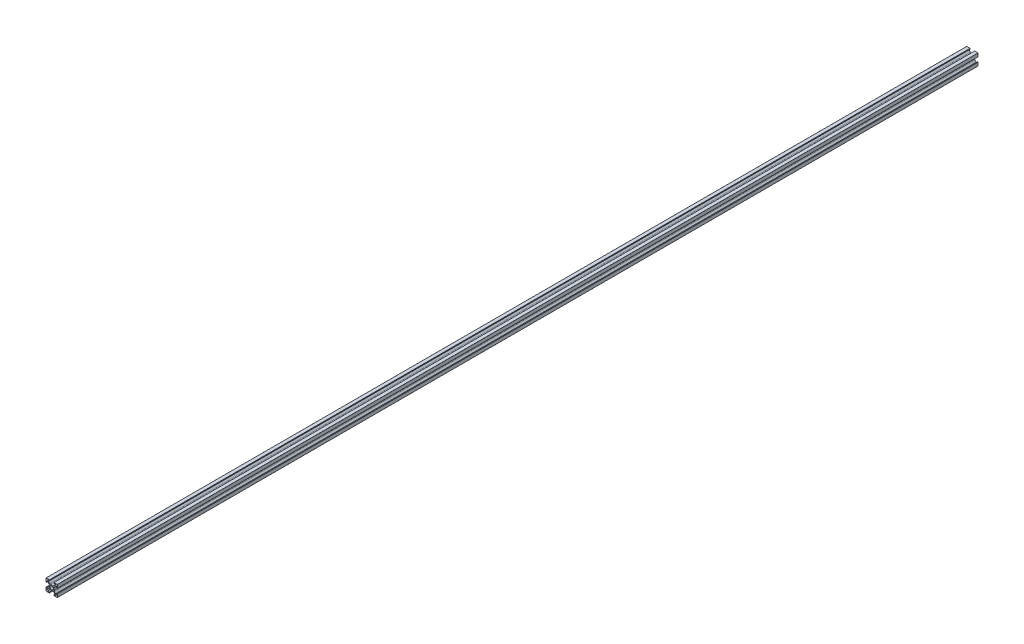
from build123d import *

# Parameters (mm, degrees)
SKETCH1_R           = 3
BOSS_EXTRUDE2_DEPTH = 1620


with BuildPart() as part:
    # Sketch1 → Boss-Extrude2 (new body)
    with BuildSketch(Plane.XY.offset(60)):
        with BuildLine():
            Line((18.5, 17.008578644), (18.5, 14.1))
            ThreePointArc((18.5, 14.1), (18.529289322, 14.029289322), (18.6, 14))
            Line((18.6, 14), (19.9, 14))
            ThreePointArc((19.9, 14), (19.970710678, 14.029289322), (20, 14.1))
            Line((20, 14.1), (20, 19.9))
            ThreePointArc((20, 19.9), (19.970710678, 19.970710678), (19.9, 20))
            Line((19.9, 20), (14.1, 20))
            ThreePointArc((14.1, 20), (14.029289322, 19.970710678), (14, 19.9))
            Line((14, 19.9), (14, 18.6))
            ThreePointArc((14, 18.6), (14.029289322, 18.529289322), (14.1, 18.5))
            Line((14.1, 18.5), (17.008578644, 18.5))
            ThreePointArc((17.008578644, 18.5), (17.100966597, 18.438268343), (17.079289322, 18.329289322))
            Line((17.079289322, 18.329289322), (13.335786438, 14.585786438))
            ThreePointArc((13.335786438, 14.585786438), (12.68693974, 14.152240935), (11.921572875, 14))
            Line((11.921572875, 14), (8.078427125, 14))
            ThreePointArc((8.078427125, 14), (7.31306026, 14.152240935), (6.664213562, 14.585786438))
            Line((6.664213562, 14.585786438), (2.920710678, 18.329289322))
            ThreePointArc((2.920710678, 18.329289322), (2.899033403, 18.438268343), (2.991421356, 18.5))
            Line((2.991421356, 18.5), (5.9, 18.5))
            ThreePointArc((5.9, 18.5), (5.970710678, 18.529289322), (6, 18.6))
            Line((6, 18.6), (6, 19.9))
            ThreePointArc((6, 19.9), (5.970710678, 19.970710678), (5.9, 20))
            Line((5.9, 20), (0.1, 20))
            ThreePointArc((0.1, 20), (0.029289322, 19.970710678), (0, 19.9))
            Line((0, 19.9), (0, 14.1))
            ThreePointArc((0, 14.1), (0.029289322, 14.029289322), (0.1, 14))
            Line((0.1, 14), (1.4, 14))
            ThreePointArc((1.4, 14), (1.470710678, 14.029289322), (1.5, 14.1))
            Line((1.5, 14.1), (1.5, 17.008578644))
            ThreePointArc((1.5, 17.008578644), (1.561731657, 17.100966597), (1.670710678, 17.079289322))
            Line((1.670710678, 17.079289322), (5.414213562, 13.335786438))
            ThreePointArc((5.414213562, 13.335786438), (5.847759065, 12.68693974), (6, 11.921572875))
            Line((6, 11.921572875), (6, 8.078427125))
            ThreePointArc((6, 8.078427125), (5.847759065, 7.31306026), (5.414213562, 6.664213562))
            Line((5.414213562, 6.664213562), (1.670710678, 2.920710678))
            ThreePointArc((1.670710678, 2.920710678), (1.561731657, 2.899033403), (1.5, 2.991421356))
            Line((1.5, 2.991421356), (1.5, 5.9))
            ThreePointArc((1.5, 5.9), (1.470710678, 5.970710678), (1.4, 6))
            Line((1.4, 6), (0.1, 6))
            ThreePointArc((0.1, 6), (0.029289322, 5.970710678), (0, 5.9))
            Line((0, 5.9), (0, 0.1))
            ThreePointArc((0, 0.1), (0.029289322, 0.029289322), (0.1, 0))
            Line((0.1, 0), (5.9, 0))
            ThreePointArc((5.9, 0), (5.970710678, 0.029289322), (6, 0.1))
            Line((6, 0.1), (6, 1.4))
            ThreePointArc((6, 1.4), (5.970710678, 1.470710678), (5.9, 1.5))
            Line((5.9, 1.5), (2.991421356, 1.5))
            ThreePointArc((2.991421356, 1.5), (2.899033403, 1.561731657), (2.920710678, 1.670710678))
            Line((2.920710678, 1.670710678), (6.664213562, 5.414213562))
            ThreePointArc((6.664213562, 5.414213562), (7.31306026, 5.847759065), (8.078427125, 6))
            Line((8.078427125, 6), (11.921572875, 6))
            ThreePointArc((11.921572875, 6), (12.68693974, 5.847759065), (13.335786438, 5.414213562))
            Line((13.335786438, 5.414213562), (17.079289322, 1.670710678))
            ThreePointArc((17.079289322, 1.670710678), (17.100966597, 1.561731657), (17.008578644, 1.5))
            Line((17.008578644, 1.5), (14.1, 1.5))
            ThreePointArc((14.1, 1.5), (14.029289322, 1.470710678), (14, 1.4))
            Line((14, 1.4), (14, 0.1))
            ThreePointArc((14, 0.1), (14.029289322, 0.029289322), (14.1, 0))
            Line((14.1, 0), (19.9, 0))
            ThreePointArc((19.9, 0), (19.970710678, 0.029289322), (20, 0.1))
            Line((20, 0.1), (20, 5.9))
            ThreePointArc((20, 5.9), (19.970710678, 5.970710678), (19.9, 6))
            Line((19.9, 6), (18.6, 6))
            ThreePointArc((18.6, 6), (18.529289322, 5.970710678), (18.5, 5.9))
            Line((18.5, 5.9), (18.5, 2.991421356))
            ThreePointArc((18.5, 2.991421356), (18.438268343, 2.899033403), (18.329289322, 2.920710678))
            Line((18.329289322, 2.920710678), (14.585786438, 6.664213562))
            ThreePointArc((14.585786438, 6.664213562), (14.152240935, 7.31306026), (14, 8.078427125))
            Line((14, 8.078427125), (14, 11.921572875))
            ThreePointArc((14, 11.921572875), (14.152240935, 12.68693974), (14.585786438, 13.335786438))
            Line((14.585786438, 13.335786438), (18.329289322, 17.079289322))
            ThreePointArc((18.329289322, 17.079289322), (18.438268343, 17.100966597), (18.5, 17.008578644))
        make_face()
        with Locations(Location((10, 10, 0), (0, 0, 180))):
            Circle(SKETCH1_R, mode=Mode.SUBTRACT)
    extrude(amount=BOSS_EXTRUDE2_DEPTH)


solid = part.part
